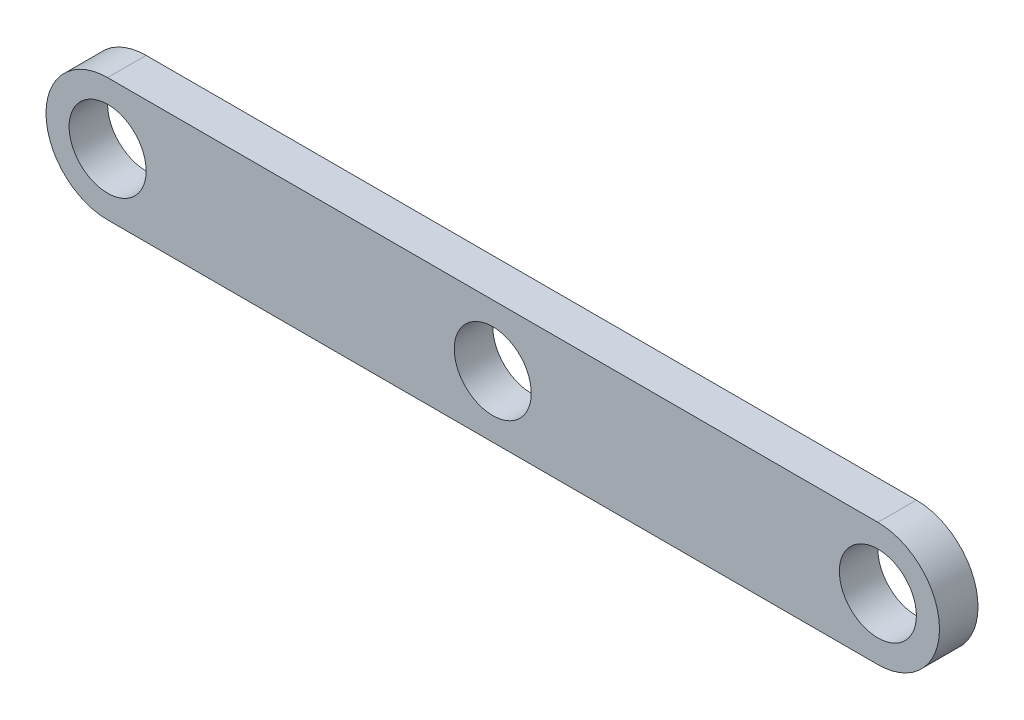
from build123d import *

# Parameters (mm, degrees)
SKETCH1_R           = 5
BOSS_EXTRUDE1_DEPTH = 2.5


with BuildPart() as part:
    # Sketch1 → Boss-Extrude1 (new, symmetric)
    with BuildSketch(Plane.XY):
        with BuildLine():
            Line((-50, 8), (50, 8))
            ThreePointArc((50, 8), (58, 0), (50, -8))
            Line((50, -8), (-50, -8))
            ThreePointArc((-50, -8), (-58, 0), (-50, 8))
        make_face()
        with Locations((-50, 0)):
            Circle(SKETCH1_R, mode=Mode.SUBTRACT)
        with Locations((50, 0)):
            Circle(SKETCH1_R, mode=Mode.SUBTRACT)
        Circle(SKETCH1_R, mode=Mode.SUBTRACT)
    extrude(amount=BOSS_EXTRUDE1_DEPTH, both=True)


solid = part.part
